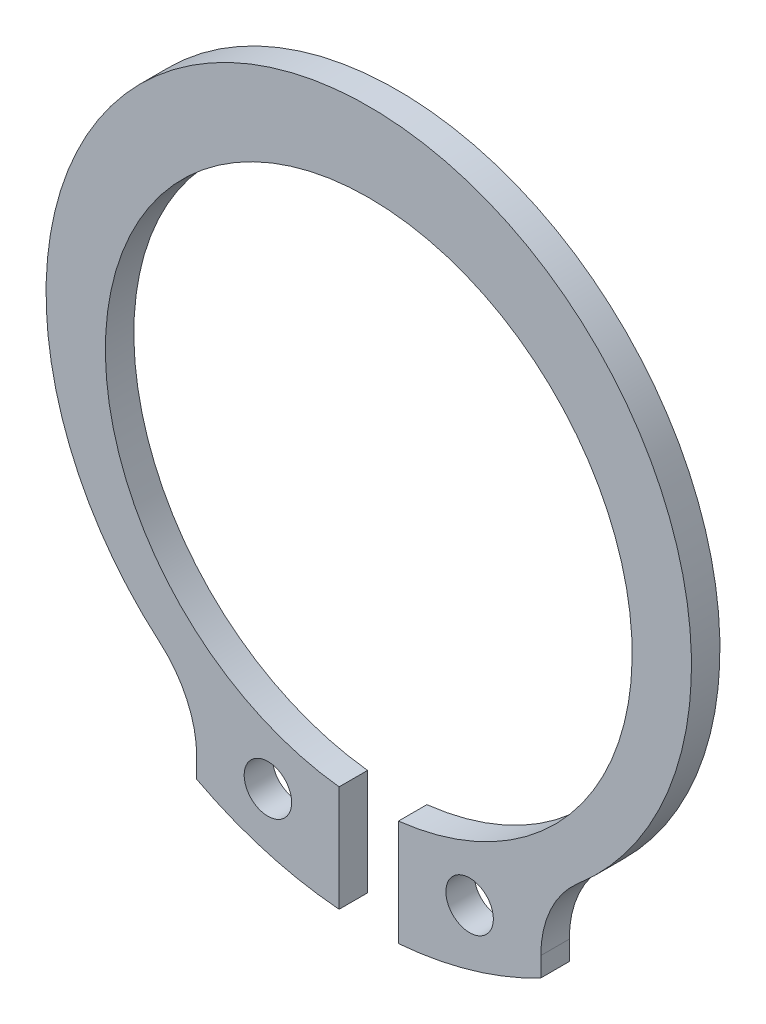
from build123d import *

# Parameters (mm, degrees)
SKETCH1_R  = 1
BODY_DEPTH = 1.2
FILLET1_R  = 4.5


with BuildPart() as part:
    # Sketch1 → Body (new body)
    with BuildSketch(Plane.XY):
        with BuildLine():
            Line((-1.25, -16.329677416), (-1.25, -11.859392549))
            ThreePointArc((-1.25, -11.859392549), (0, 10.27), (1.25, -11.859392549))
            Line((1.25, -11.859392549), (1.25, -16.329677416))
            ThreePointArc((1.25, -16.329677416), (4.338456847, -15.762524642), (7.25, -14.586453031))
            Line((7.25, -14.586453031), (7.25, -11.506411256))
            ThreePointArc((7.25, -11.506411256), (0, 13.6), (-7.25, -11.506411256))
            Line((-7.25, -11.506411256), (-7.25, -14.586453031))
            ThreePointArc((-7.25, -14.586453031), (-4.338456847, -15.762524642), (-1.25, -16.329677416))
        make_face()
        with Locations((-4.25, -13.432678287)):
            Circle(SKETCH1_R, mode=Mode.SUBTRACT)
        with Locations(Location((4.25, -13.432678287, 0), (0, 0, 180))):
            Circle(SKETCH1_R, mode=Mode.SUBTRACT)
    extrude(amount=-BODY_DEPTH)

    # Fillet1
    fillet1_edges = [part.edges().sort_by_distance(p)[0] for p in [
        (7.25, -11.506411256, -0.6),
        (-7.25, -11.506411256, -0.6),
    ]]
    fillet(fillet1_edges, radius=FILLET1_R)


solid = part.part
